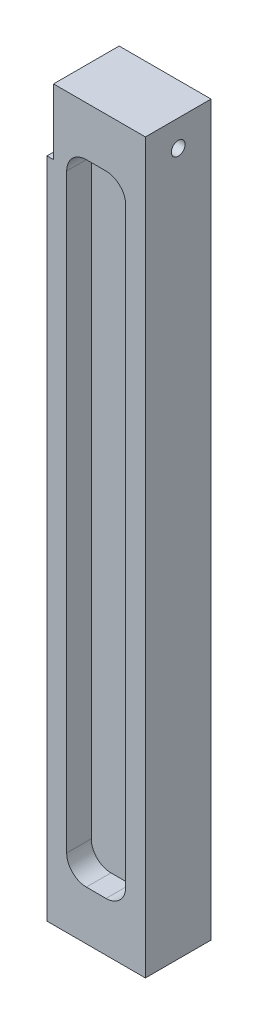
from build123d import *

# Parameters (mm, degrees)
SKETCH_1_W             = 30
SKETCH_1_H             = 20
EXTRUDE_1_DEPTH        = 222
CUT_EXTRUDE_1_DEPTH    = 7.5
HOLE_WIZARD_M5_1_D     = 4.2
HOLE_WIZARD_M5_1_DEPTH = 14
HOLE_WIZARD_M5_1_TIP   = 1.2618073
HOLE_WIZARD_M5_2_D     = 4.2
CUT_EXTRUDE_2_DEPTH    = 224.403222895


with BuildPart() as part:
    # 草图1 → 凸台-拉伸1 (new body)
    with BuildSketch(Plane(origin=(0, 0, 0), x_dir=(1, 0, 0), z_dir=(0, 1, 0))):
        Rectangle(SKETCH_1_W, SKETCH_1_H)
    extrude(amount=EXTRUDE_1_DEPTH)

    # 草图2 → 切除-拉伸1 (cut)
    with BuildSketch(Plane.XY.offset(-10)):
        with BuildLine():
            Line((-3, 15), (3, 15))
            ThreePointArc((3, 15), (7.242640687, 16.757359313), (9, 21))
            Line((9, 21), (9, 201))
            ThreePointArc((9, 201), (7.242640687, 205.242640687), (3, 207))
            Line((3, 207), (-3, 207))
            ThreePointArc((-3, 207), (-7.242640687, 205.242640687), (-9, 201))
            Line((-9, 201), (-9, 21))
            ThreePointArc((-9, 21), (-7.242640687, 16.757359313), (-3, 15))
        make_face()
    cut_extrude_1 = extrude(amount=CUT_EXTRUDE_1_DEPTH, mode=Mode.SUBTRACT)

    # 镜向1: 切除-拉伸1 across plane
    add(cut_extrude_1.mirror(Plane.XY), mode=Mode.SUBTRACT)

    # M5 螺纹孔1
    with Locations(Plane(origin=(0, 0, 0), x_dir=(-1, 0, 0), z_dir=(0, -1, 0))):
        with Locations((8, 0), (-8, 0)):
            Hole(HOLE_WIZARD_M5_1_D / 2, depth=HOLE_WIZARD_M5_1_DEPTH)
            with Locations((0, 0, -(HOLE_WIZARD_M5_1_DEPTH + HOLE_WIZARD_M5_1_TIP / 2))):  # 118° drill point
                Cone(0, HOLE_WIZARD_M5_1_D / 2, HOLE_WIZARD_M5_1_TIP, mode=Mode.SUBTRACT)

    # M5 螺纹孔2 (through all)
    with Locations(Plane(origin=(15, 0, 0), x_dir=(0, 0, -1), z_dir=(1, 0, 0))):
        with Locations((0, 214)):
            Hole(HOLE_WIZARD_M5_2_D / 2)

    # 草图7 → 切除-拉伸2 (cut, through all)
    with BuildSketch(Plane(origin=(0, 0, 10), x_dir=(-1, 0, 0), z_dir=(0, 0, -1))):
        Polygon((13, 679.517597419), (13, 222), (13, 202), (15, 202), (472.517597419, 202), (1131.852642703, 836.481446423), (672.335045283, 1313.999043842), align=None)
    extrude(amount=CUT_EXTRUDE_2_DEPTH, mode=Mode.SUBTRACT)


solid = part.part
